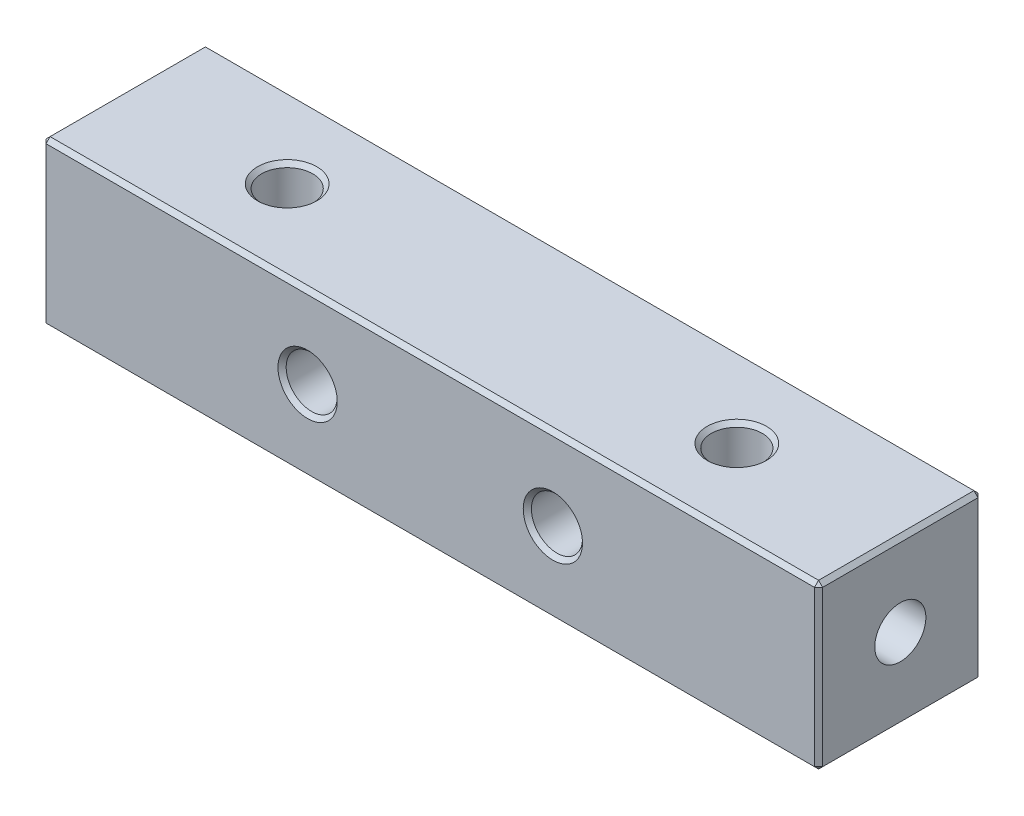
from build123d import *

# Parameters (mm, degrees)
SKETCH_1_W              = 38
SKETCH_1_H              = 8
EXTRUDE_1_DEPTH         = 4
HOLE_WIZARD_M3_1_D      = 2.5
HOLE_WIZARD_M3_2_D      = 2.5
CHAMFER_1_SIZE          = 0.2
HOLE_WIZARD_M3_3_REACH  = 40.419
HOLE_WIZARD_M3_3_BORE_R = 1.25
HOLE_WIZARD_M3_4_REACH  = 40.419
HOLE_WIZARD_M3_4_BORE_R = 1.25


with BuildPart() as part:
    # 草图1 → 凸台-拉伸1 (new, symmetric)
    with BuildSketch(Plane(origin=(0, 0, 0), x_dir=(1, 0, 0), z_dir=(0, 1, 0))):
        Rectangle(SKETCH_1_W, SKETCH_1_H)
    extrude(amount=EXTRUDE_1_DEPTH, both=True)

    # M3 螺纹孔1 (through all)
    with Locations(Plane(origin=(0, 4, 0), x_dir=(1, 0, 0), z_dir=(0, 1, 0))):
        with Locations((-11, 0), (11, 0)):
            Hole(HOLE_WIZARD_M3_1_D / 2)

    # M3 螺纹孔2 (through all)
    with Locations(Plane(origin=(0, 0, -4), x_dir=(-1, 0, 0), z_dir=(0, 0, -1))):
        with Locations((-6, 0), (6, 0)):
            Hole(HOLE_WIZARD_M3_2_D / 2)

    # 倒角1
    chamfer_1_edges = [part.edges().sort_by_distance(p)[0] for p in [
        (-19, 4, 0),
        (12.25, 4, 0),
        (12.25, -4, 0),
        (0, 4, 4),
        (-9.75, 4, 0),
        (-9.75, -4, 0),
        (-7.25, 0, -4),
        (-7.25, 0, 4),
        (4.75, 0, -4),
        (4.75, 0, 4),
        (19, 4, 0),
        (0, -4, 4),
        (-19, -4, 0),
        (0, -4, -4),
        (19, -4, 0),
        (19, 0, 4),
        (-19, 0, 4),
        (-19, 0, -4),
        (19, 0, -4),
        (0, 4, -4),
    ]]
    chamfer(chamfer_1_edges, length=CHAMFER_1_SIZE)

    # M3 螺纹孔3 bore → M3 螺纹孔3 (cut, up to next)
    with BuildSketch(Plane.ZY.offset(19), mode=Mode.PRIVATE) as hole_wizard_m3_3_sk1:
        Circle(HOLE_WIZARD_M3_3_BORE_R)
    hole_wizard_m3_3_tool1 = extrude(hole_wizard_m3_3_sk1.sketch, amount=-HOLE_WIZARD_M3_3_REACH, mode=Mode.PRIVATE) & part.part
    add(hole_wizard_m3_3_tool1.solids().sort_by_distance((-19, 0, 0))[0], mode=Mode.SUBTRACT)

    # M3 螺纹孔4 bore → M3 螺纹孔4 (cut, up to next)
    with BuildSketch(Plane(origin=(19, 0, 0), x_dir=(0, 0, -1), z_dir=(1, 0, 0)), mode=Mode.PRIVATE) as hole_wizard_m3_4_sk1:
        Circle(HOLE_WIZARD_M3_4_BORE_R)
    hole_wizard_m3_4_tool1 = extrude(hole_wizard_m3_4_sk1.sketch, amount=-HOLE_WIZARD_M3_4_REACH, mode=Mode.PRIVATE) & part.part
    add(hole_wizard_m3_4_tool1.solids().sort_by_distance((19, 0, 0))[0], mode=Mode.SUBTRACT)


solid = part.part
